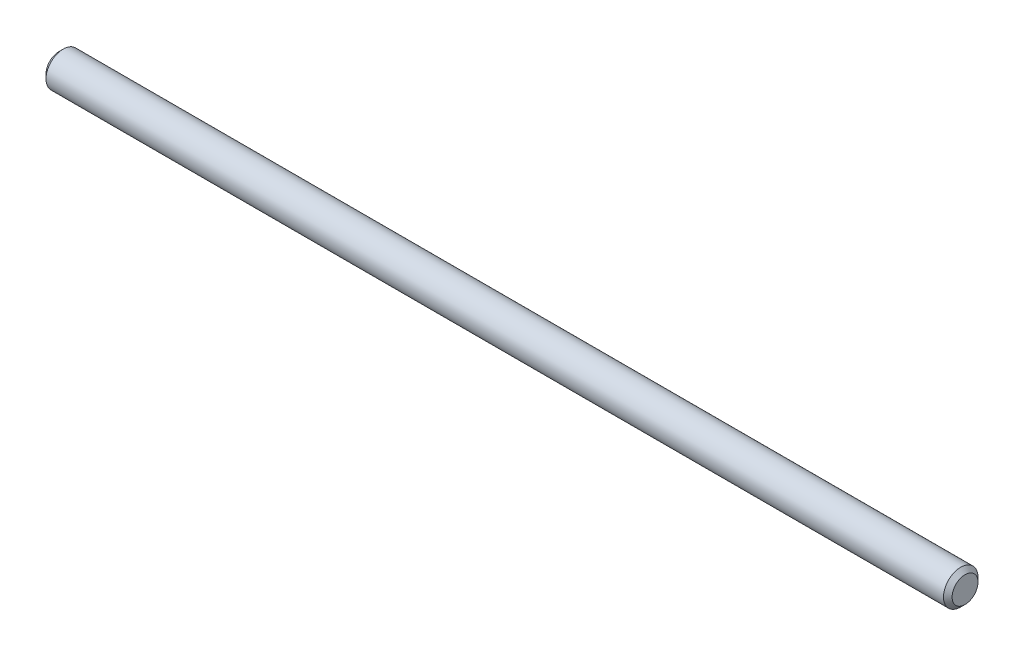
from build123d import *

# Parameters (mm, degrees)
SKETCH1_R           = 2
BOSS_EXTRUDE1_DEPTH = 52.5
CHAMFER1_SIZE       = 0.5


with BuildPart() as part:
    # Sketch1 → Boss-Extrude1 (new, symmetric)
    with BuildSketch(Plane(origin=(0, 0, 0), x_dir=(0, 0, -1), z_dir=(1, 0, 0))):
        Circle(SKETCH1_R)
    extrude(amount=BOSS_EXTRUDE1_DEPTH, both=True)

    # Chamfer1
    chamfer1_edges = [part.edges().sort_by_distance(p)[0] for p in [
        (-52.5, 0, 2),
        (52.5, 0, 2),
    ]]
    chamfer(chamfer1_edges, length=CHAMFER1_SIZE)


solid = part.part
